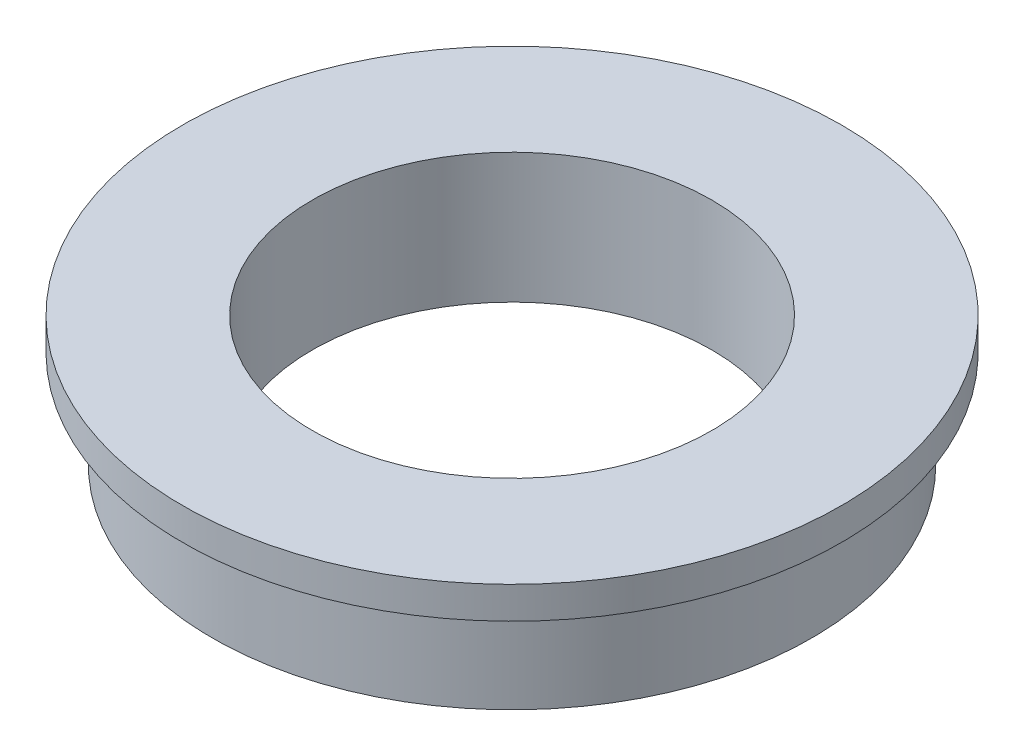
from build123d import *


with BuildPart() as part:
    # ｽｹｯﾁ1 → 回転1 (revolve)
    with BuildSketch(Plane.XY, mode=Mode.PRIVATE) as revolve_1_sk:
        Polygon((5, 0.8), (5, -2.45), (7.5, -2.45), (7.5, 0), (8.25, 0), (8.25, 0.8), align=None)
    revolve(revolve_1_sk.sketch.rotate(Axis((0, 0, 0), (0, 1, 0)), 90), axis=Axis((0, 0, 0), (0, 1, 0)))


solid = part.part
